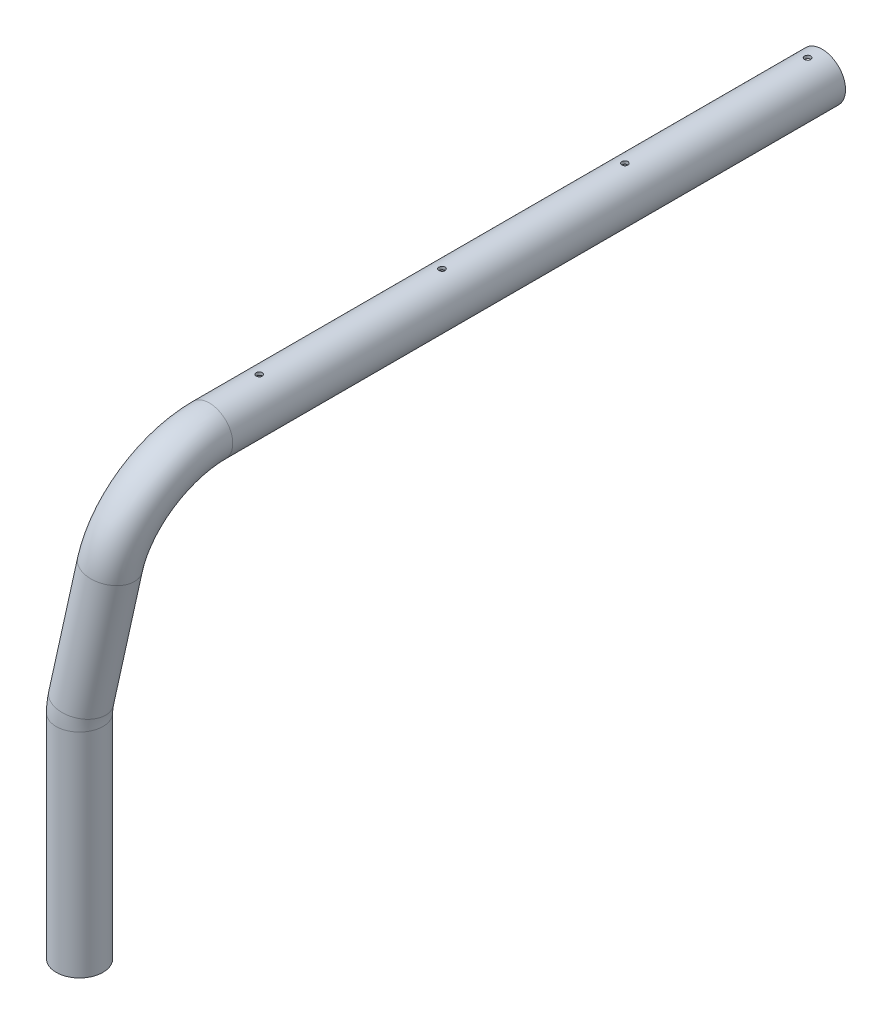
from build123d import *

# Parameters (mm, degrees)
ESBO_O1_R                  = 16
ESBO_O1_R_2                = 14
FURO_ROSCADO_DE_M51_REACH  = 578.936
FURO_ROSCADO_DE_M51_BORE_R = 2.1
PADR_O_LINEAR1_COUNT       = 4
PADR_O_LINEAR1_PITCH       = 125


with BuildPart() as part:
    # Varredura1: sweep along a curve in space
    with BuildLine() as varredura1_path:
        Line((0, 0, 0), (0, 145.625566824, 0))
        ThreePointArc((0, 145.625566824, 0), (0.164564067, 149.983353961, -0.095495939), (0.657003837, 154.307975707, -0.381256973))
        Line((0.657003837, 154.307975707, -0.381256973), (13.126220085, 236.068655986, -7.617098481))
        ThreePointArc((13.126220085, 236.068655986, -7.617098481), (19.007173448, 274.630081024, -26.85336791), (21.383743837, 290.213258656, -67.388780367))
        Line((21.383743837, 290.213258656, -67.388780367), (21.383743837, 290.213258656, -486.408909926))
    # Esboço1 → Varredura1 (sweep)
    with BuildSketch(Plane(origin=(0, 0, 0), x_dir=(1, 0, 0), z_dir=(0, 1, 0))):
        Circle(ESBO_O1_R)
        Circle(ESBO_O1_R_2, mode=Mode.SUBTRACT)
    sweep(path=varredura1_path.line)

    # Furo roscado de M51 bore → Furo roscado de M51 (cut, up to next)
    with BuildSketch(Plane(origin=(0, 308, 0), x_dir=(1, 0, 0), z_dir=(0, 1, 0)), mode=Mode.PRIVATE) as furo_roscado_de_m51_sk1:
        with Locations((21.383743837, 476.408909926)):
            Circle(FURO_ROSCADO_DE_M51_BORE_R)
    furo_roscado_de_m51_tool1 = extrude(furo_roscado_de_m51_sk1.sketch, amount=-FURO_ROSCADO_DE_M51_REACH, mode=Mode.PRIVATE) & part.part
    furo_roscado_de_m51 = furo_roscado_de_m51_tool1.solids().sort_by_distance((21.383744, 308, -476.40891))[0]
    add(furo_roscado_de_m51, mode=Mode.SUBTRACT)

    # Padrão linear1: Furo roscado de M51 ×4
    with Locations(*[(0, 0, i * PADR_O_LINEAR1_PITCH) for i in range(1, PADR_O_LINEAR1_COUNT)]):
        add(furo_roscado_de_m51, mode=Mode.SUBTRACT)


solid = part.part
